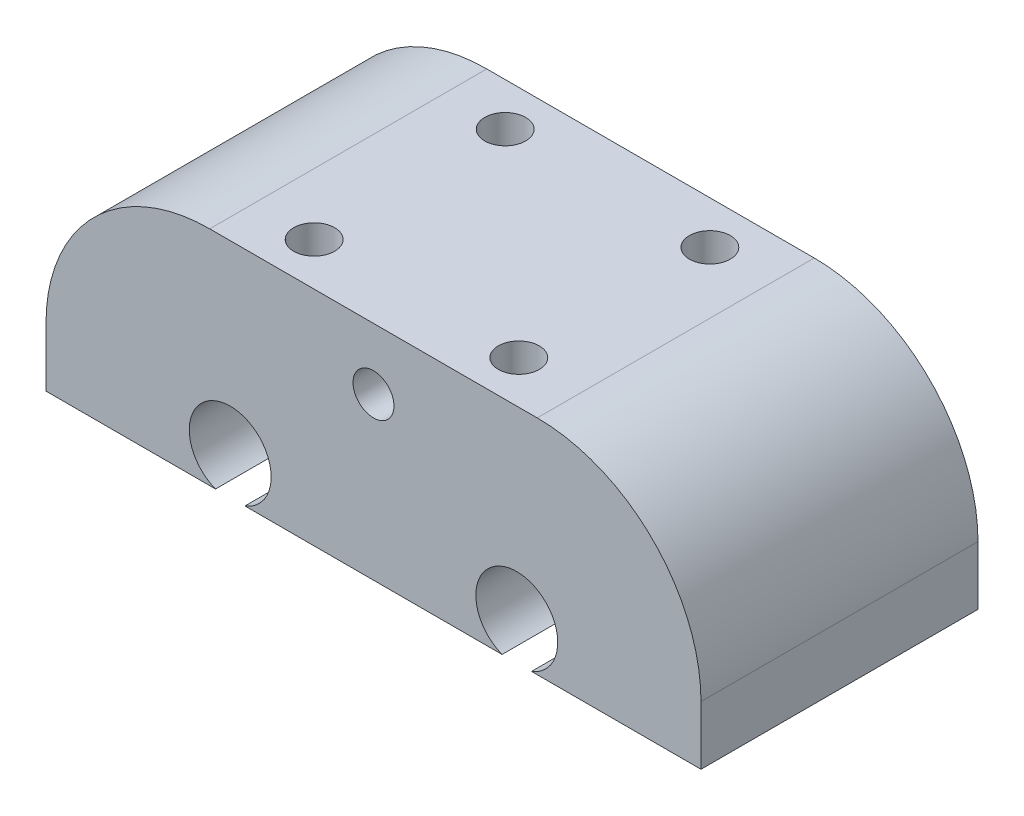
from build123d import *

# Parameters (mm, degrees)
SKETCH1_W           = 48
SKETCH1_H           = 20.3
BOSS_EXTRUDE1_DEPTH = 16.3
SKETCH2_R           = 3
CUT_EXTRUDE1_DEPTH  = 55.605677361
CUT_EXTRUDE2_DEPTH  = 3.5
FILLET1_R           = 12
SKETCH4_R           = 1.5
CUT_EXTRUDE3_DEPTH  = 55.605677361
SKETCH5_R           = 1.5
CUT_EXTRUDE4_DEPTH  = 8


with BuildPart() as part:
    # Sketch1 → Boss-Extrude1 (new body)
    with BuildSketch(Plane(origin=(0, 0, 0), x_dir=(1, 0, 0), z_dir=(0, 1, 0))):
        with Locations((24, -10.15)):
            Rectangle(SKETCH1_W, SKETCH1_H)
    extrude(amount=BOSS_EXTRUDE1_DEPTH)

    # Sketch2 → Cut-Extrude1 (cut, through all)
    with BuildSketch(Plane.XY.offset(20.3)):
        with Locations((13.5, 2.8)):
            Circle(SKETCH2_R)
        with Locations((34.5, 2.8)):
            Circle(SKETCH2_R)
    extrude(amount=-CUT_EXTRUDE1_DEPTH, mode=Mode.SUBTRACT)

    # Sketch3 → Cut-Extrude2 (cut, symmetric)
    with BuildSketch(Plane.XY.offset(10.3)):
        with BuildLine():
            Line((3.5, 2.8), (3.5, -6.25))
            Line((3.5, -6.25), (23.495503035, -6.25))
            Line((23.495503035, -6.25), (23.495503035, 3.099865091))
            ThreePointArc((23.495503035, 3.099865091), (13.350050596, 12.798875696), (3.5, 2.8))
        make_face()
        with BuildLine():
            Line((24.5, 2.8), (24.5, -6.25))
            Line((24.5, -6.25), (44.495503035, -6.25))
            Line((44.495503035, -6.25), (44.495503035, 3.099865091))
            ThreePointArc((44.495503035, 3.099865091), (34.350050596, 12.798875696), (24.5, 2.8))
        make_face()
    extrude(amount=CUT_EXTRUDE2_DEPTH, both=True, mode=Mode.SUBTRACT)

    # Fillet1
    fillet1_edges = [part.edges().sort_by_distance(p)[0] for p in [
        (48, 16.3, 10.15),
        (0, 16.3, 10.15),
    ]]
    fillet(fillet1_edges, radius=FILLET1_R)

    # Sketch4 → Cut-Extrude3 (cut, through all)
    with BuildSketch(Plane(origin=(0, 0, 0), x_dir=(-1, 0, 0), z_dir=(0, 0, -1))):
        with Locations((-24, 11.8)):
            Circle(SKETCH4_R)
    extrude(amount=-CUT_EXTRUDE3_DEPTH, mode=Mode.SUBTRACT)

    # Sketch5 → Cut-Extrude4 (cut)
    with BuildSketch(Plane(origin=(0, 16.3, 0), x_dir=(1, 0, 0), z_dir=(0, 1, 0))):
        with Locations(Location((31.5, -17.15, 0), (0, 0, 270))):
            Circle(SKETCH5_R)
        with Locations(Location((16.5, -17.15, 0), (0, 0, 270))):
            Circle(SKETCH5_R)
        with Locations(Location((16.5, -3.15, 0), (0, 0, 270))):
            Circle(SKETCH5_R)
        with Locations(Location((31.5, -3.15, 0), (0, 0, 270))):
            Circle(SKETCH5_R)
    extrude(amount=-CUT_EXTRUDE4_DEPTH, mode=Mode.SUBTRACT)


solid = part.part
